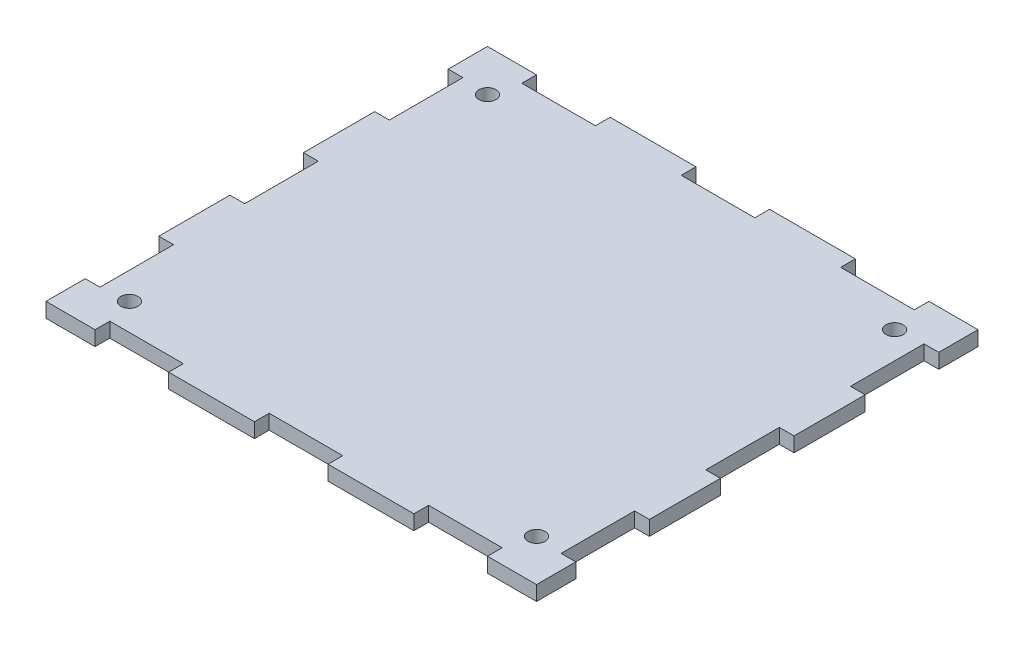
from build123d import *

# Parameters (mm, degrees)
SKETCH_1_R      = 1.75
EXTRUDE_1_DEPTH = 3


with BuildPart() as part:
    # 草图1 → 凸台-拉伸1 (new body)
    with BuildSketch(Plane(origin=(0, 0, 0), x_dir=(1, 0, 0), z_dir=(0, 1, 0))):
        Polygon((-50, -45), (-40, -45), (-40, -42), (-25, -42), (-25, -45), (-7.5, -45), (-7.5, -42), (7.5, -42), (7.5, -45), (25, -45), (25, -42), (40, -42), (40, -45), (50, -45), (50, -37), (47, -37), (47, -22), (50, -22), (50, -7.5), (47, -7.5), (47, 7.5), (50, 7.5), (50, 22), (47, 22), (47, 37), (50, 37), (50, 45), (40, 45), (40, 42), (25, 42), (25, 45), (7.5, 45), (7.5, 42), (-7.5, 42), (-7.5, 45), (-25, 45), (-25, 42), (-40, 42), (-40, 45), (-50, 45), (-50, 37), (-47, 37), (-47, 22), (-50, 22), (-50, 7.5), (-47, 7.5), (-47, -7.5), (-50, -7.5), (-50, -22), (-47, -22), (-47, -37), (-50, -37), align=None)
        with Locations(Location((-41.5, 36.5, 0), (0, 0, 270))):
            Circle(SKETCH_1_R, mode=Mode.SUBTRACT)
        with Locations(Location((41.5, 36.5, 0), (0, 0, 270))):
            Circle(SKETCH_1_R, mode=Mode.SUBTRACT)
        with Locations(Location((41.5, -36.5, 0), (0, 0, 270))):
            Circle(SKETCH_1_R, mode=Mode.SUBTRACT)
        with Locations(Location((-41.5, -36.5, 0), (0, 0, 270))):
            Circle(SKETCH_1_R, mode=Mode.SUBTRACT)
    extrude(amount=EXTRUDE_1_DEPTH)


solid = part.part
